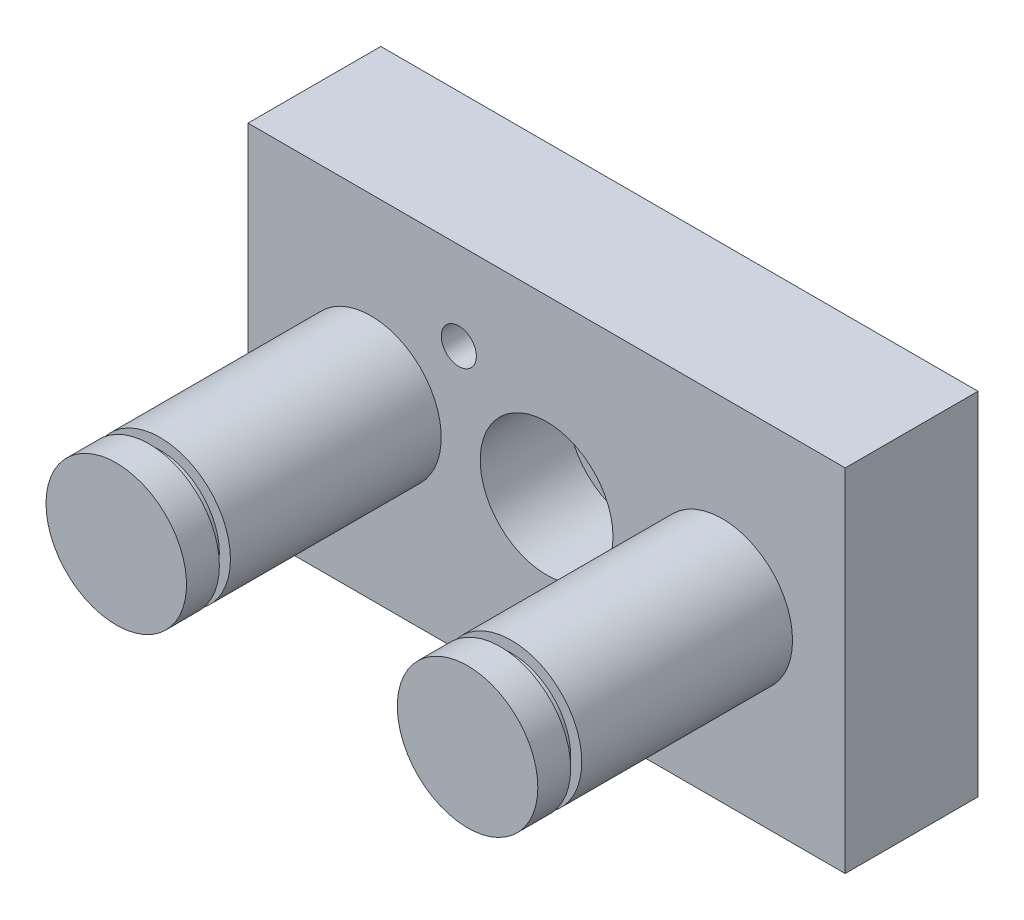
from build123d import *

# Parameters (mm, degrees)
CROQUIS1_W              = 53.975
CROQUIS1_H              = 31.75
SALIENTE_EXTRUIR1_DEPTH = 12
CROQUIS2_R              = 3.969
CORTAR_EXTRUIR1_DEPTH   = 34.53119117
CROQUIS3_R              = 6.0015
CORTAR_EXTRUIR2_DEPTH   = 7.938
CROQUIS4_R              = 1.5875
CORTAR_EXTRUIR3_DEPTH   = 34.53119117
CROQUIS5_R              = 3.969
CORTAR_EXTRUIR4_DEPTH   = 34.53119117
CROQUIS12_W             = 1
CROQUIS12_H             = 1
CROQUIS13_W             = 1
CROQUIS13_H             = 1


with BuildPart() as part:
    # Croquis1 → Saliente-Extruir1 (new body)
    with BuildSketch(Plane.XY):
        Rectangle(CROQUIS1_W, CROQUIS1_H)
    extrude(amount=SALIENTE_EXTRUIR1_DEPTH)

    # Croquis2 → Cortar-Extruir1 (cut, through all)
    with BuildSketch(Plane.XY.offset(12)):
        Circle(CROQUIS2_R)
    extrude(amount=-CORTAR_EXTRUIR1_DEPTH, mode=Mode.SUBTRACT)

    # Croquis3 → Cortar-Extruir2 (cut)
    with BuildSketch(Plane.XY.offset(12)):
        Circle(CROQUIS3_R)
    extrude(amount=-CORTAR_EXTRUIR2_DEPTH, mode=Mode.SUBTRACT)

    # Croquis4 → Cortar-Extruir3 (cut, through all)
    with BuildSketch(Plane.XY.offset(12)):
        with Locations((7.9375, -7.9375)):
            Circle(CROQUIS4_R)
        with Locations((-7.9375, 7.9375)):
            Circle(CROQUIS4_R)
    extrude(amount=-CORTAR_EXTRUIR3_DEPTH, mode=Mode.SUBTRACT)

    # Croquis5 → Cortar-Extruir4 (cut, through all)
    with BuildSketch(Plane.XY.offset(12)):
        with Locations((-15.875, 0)):
            Circle(CROQUIS5_R)
        with Locations((15.875, 0)):
            Circle(CROQUIS5_R)
    extrude(amount=-CORTAR_EXTRUIR4_DEPTH, mode=Mode.SUBTRACT)


with BuildPart() as body_2:
    # Croquis6 → Revolución3 (revolve)
    with BuildSketch(Plane(origin=(0, 0, 0), x_dir=(1, 0, 0), z_dir=(0, 1, 0)), mode=Mode.PRIVATE) as revoluci_n3_sk:
        Polygon((-15.875, -1.191), (-15.875, -35.019), (-9.525, -35.019), (-9.525, -12), (-11.906, -12), (-11.906, -1.191), align=None)
    revolve(revoluci_n3_sk.sketch.rotate(Axis((-15.875, 0, 0), (0, 0, 1)), 180), axis=Axis((-15.875, 0, 0), (0, 0, 1)))

    # Croquis12 → Cortar-Revolución3 (revolve, cut)
    with BuildSketch(Plane(origin=(0, 0, 0), x_dir=(1, 0, 0), z_dir=(0, 1, 0)), mode=Mode.PRIVATE) as cortar_revoluci_n3_sk:
        with Locations((-10.025, -31.55)):
            Rectangle(CROQUIS12_W, CROQUIS12_H)
    revolve(cortar_revoluci_n3_sk.sketch.rotate(Axis((-15.875, 0, 35.019), (0, 0, -1)), 180), axis=Axis((-15.875, 0, 35.019), (0, 0, -1)), mode=Mode.SUBTRACT)


with BuildPart() as body_3:
    # Croquis8 → Revolución4 (revolve)
    with BuildSketch(Plane(origin=(0, 0, 0), x_dir=(1, 0, 0), z_dir=(0, 1, 0)), mode=Mode.PRIVATE) as revoluci_n4_sk:
        Polygon((15.875, -1.191), (15.875, -35.019), (9.525, -35.019), (9.525, -12), (11.906, -12), (11.906, -1.191), align=None)
    revolve(revoluci_n4_sk.sketch.rotate(Axis((15.875, 0, 12), (0, 0, -1)), 180), axis=Axis((15.875, 0, 12), (0, 0, -1)))

    # Croquis13 → Cortar-Revolución4 (revolve, cut)
    with BuildSketch(Plane(origin=(0, 0, 0), x_dir=(1, 0, 0), z_dir=(0, 1, 0))):
        with Locations((21.725, -31.55)):
            Rectangle(CROQUIS13_W, CROQUIS13_H)
    revolve(axis=Axis((15.875, 0, 35.019), (0, 0, -1)), mode=Mode.SUBTRACT)


solid = Compound([part.part, body_2.part, body_3.part])
